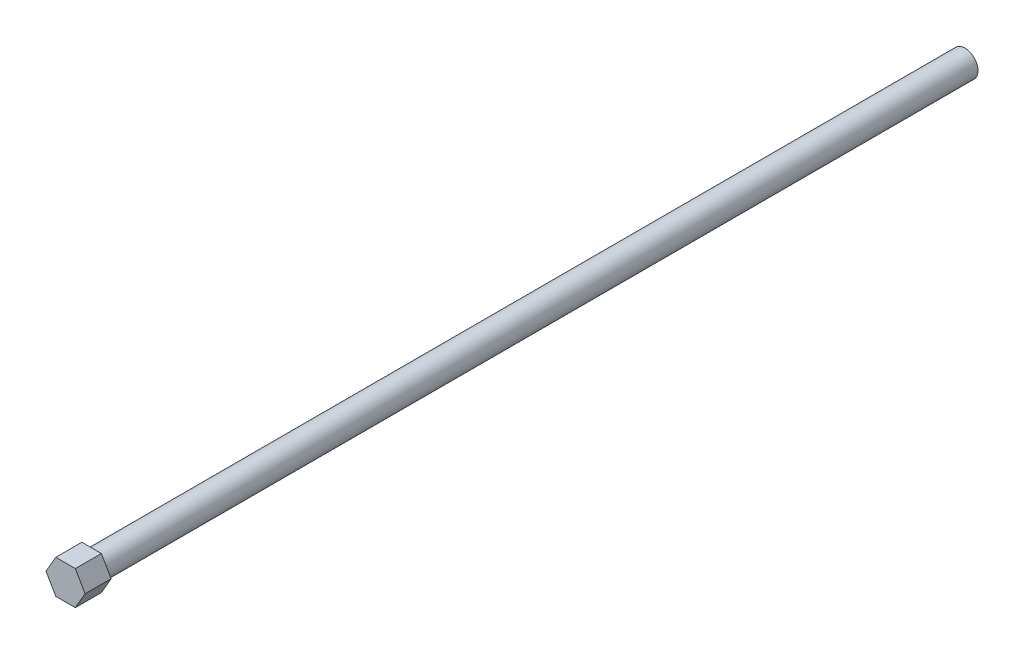
from build123d import *

# Parameters (mm, degrees)
SKETCH_1_R      = 5
EXTRUDE_1_DEPTH = 280
EXTRUDE_2_DEPTH = 10
EXTRUDE_START   = 55
SKETCH_3_R      = 5
EXTRUDE_3_DEPTH = 55


with BuildPart() as part:
    # 草图1 → 凸台-拉伸1 (new body)
    with BuildSketch(Plane.XY):
        Circle(SKETCH_1_R)
    extrude(amount=EXTRUDE_1_DEPTH)

    # 草图2 → 凸台-拉伸2 (add)
    with BuildSketch(Plane.XY.offset(280)):
        Polygon((3.75, -6.495190528), (7.5, 0), (3.75, 6.495190528), (-3.75, 6.495190528), (-7.5, 0), (-3.75, -6.495190528), align=None)
    extrude(amount=EXTRUDE_2_DEPTH)

    # 草图3 → 凸台-拉伸3 (add)
    with BuildSketch(Plane(origin=(0, 0, 0), x_dir=(-1, 0, 0), z_dir=(0, 0, -1)).offset(EXTRUDE_START)):
        Circle(SKETCH_3_R)
    extrude(amount=-EXTRUDE_3_DEPTH)


solid = part.part
